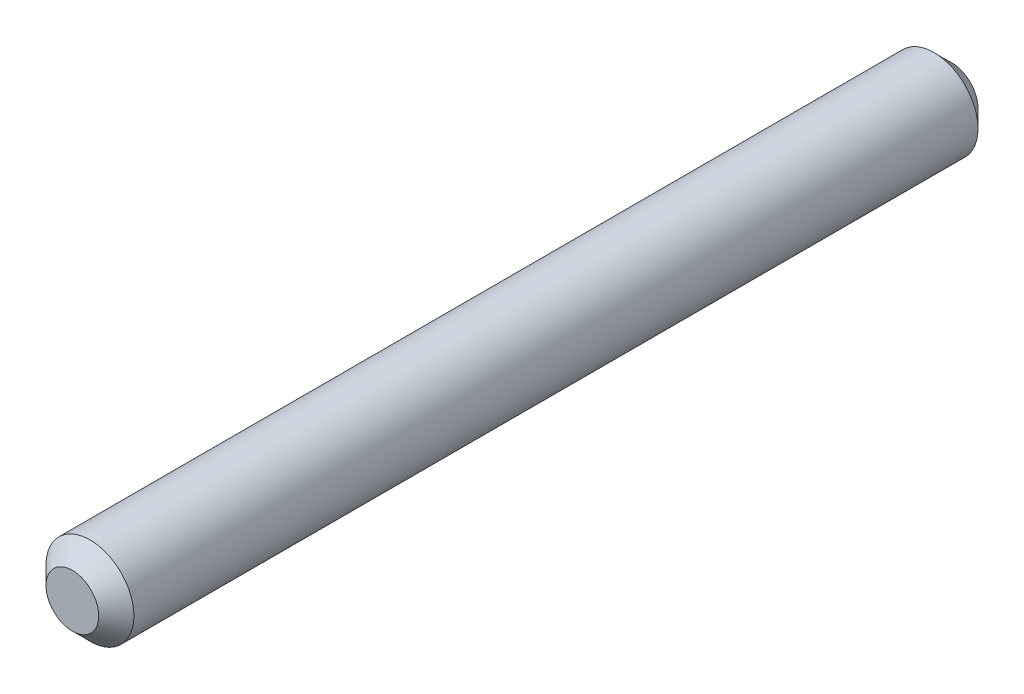
from build123d import *

# Parameters (mm, degrees)
SKETCH1_R           = 6.35
BOSS_EXTRUDE1_DEPTH = 127
CHAMFER1_SIZE       = 2.54


with BuildPart() as part:
    # Sketch1 → Boss-Extrude1 (new body)
    with BuildSketch(Plane.XY):
        Circle(SKETCH1_R)
    extrude(amount=-BOSS_EXTRUDE1_DEPTH)

    # Chamfer1
    chamfer1_edges = [part.edges().sort_by_distance(p)[0] for p in [
        (-6.35, 0, 0),
        (-6.35, 0, -127),
    ]]
    chamfer(chamfer1_edges, length=CHAMFER1_SIZE)


solid = part.part
